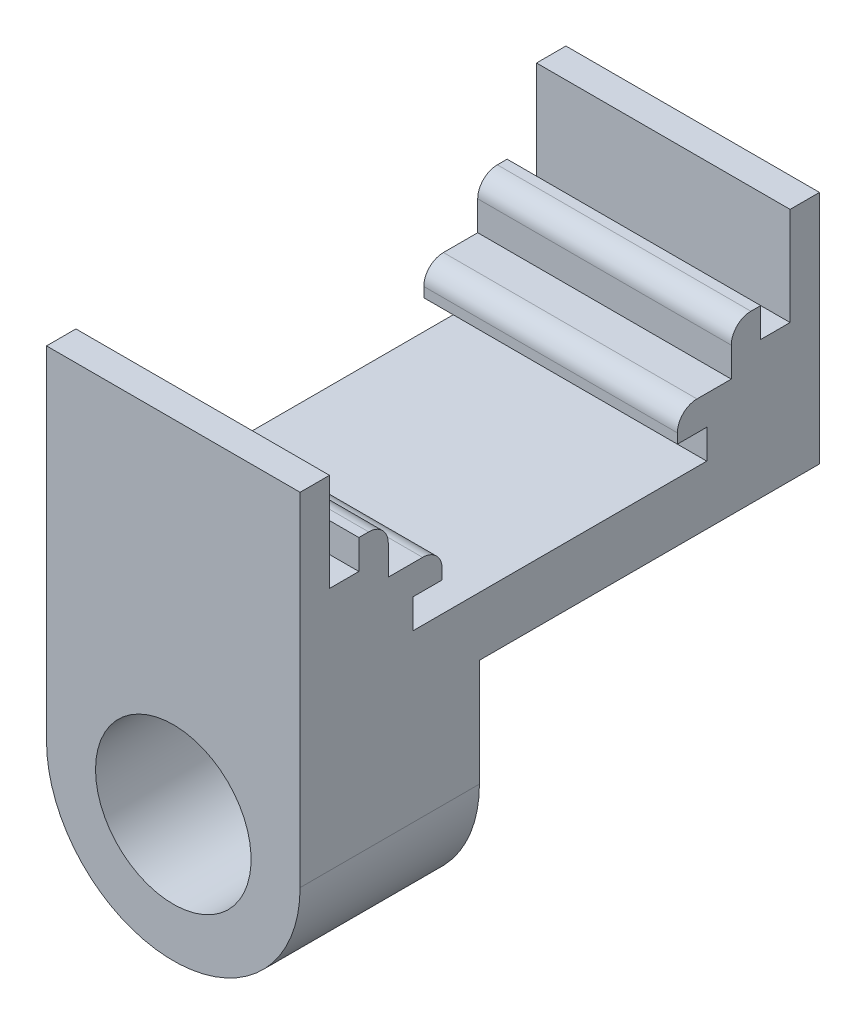
from build123d import *

# Parameters (mm, degrees)
BOSS_EXTRUDE1_DEPTH = 25.875
FILLET1_R           = 2
SKETCH2_R           = 7.9375
BOSS_EXTRUDE2_DEPTH = 18.3
SKETCH3_W           = 25.875
SKETCH3_H           = 34.7
BOSS_EXTRUDE3_DEPTH = 2


with BuildPart() as part:
    # Sketch1 → Boss-Extrude1 (new body)
    with BuildSketch(Plane(origin=(0, 0, 0), x_dir=(0, 0, -1), z_dir=(1, 0, 0))):
        Polygon((-26.5, -27.5), (-26.5, -5.5), (-23.5, -5.5), (-23.5, -15.5), (-20.5, -15.5), (-20.5, -12.5), (-17.5, -12.5), (-17.5, -17.5), (-12, -17.5), (-12, -20.5), (-15, -20.5), (-15, -23.5), (0, -23.5), (0, -27.5), align=None)
    extrude(amount=BOSS_EXTRUDE1_DEPTH)

    # Fillet1
    fillet1_edges = [part.edges().sort_by_distance(p)[0] for p in [
        (12.9375, -12.5, 17.5),
        (12.9375, -17.5, 12),
    ]]
    fillet(fillet1_edges, radius=FILLET1_R)

    # Mirror1: part across plane


with BuildPart() as part_1:
    add(part.part)
    add(part.part.mirror(Plane(origin=(25.875, -23.5, 0), x_dir=(1, 0, 0), z_dir=(0, 0, 1))))

    # Sketch2 → Boss-Extrude2 (add)
    with BuildSketch(Plane(origin=(0, 0, 26.5), x_dir=(-1, 0, 0), z_dir=(0, 0, -1))):
        with BuildLine():
            Line((-25.875, -27.5), (-25.875, -40.4375))
            ThreePointArc((-25.875, -40.4375), (-12.9375, -53.375), (0, -40.4375))
            Line((0, -40.4375), (0, -27.5))
            Line((0, -27.5), (0, -23.5))
            Line((0, -23.5), (-25.875, -23.5))
            Line((-25.875, -23.5), (-25.875, -27.5))
        make_face()
        with Locations((-12.9375, -40.4375)):
            Circle(SKETCH2_R, mode=Mode.SUBTRACT)
    extrude(amount=BOSS_EXTRUDE2_DEPTH)

    # Sketch3 → Boss-Extrude3 (add)
    with BuildSketch(Plane.XZ.offset(27.5)):
        with Locations((12.9375, -9.15)):
            Rectangle(SKETCH3_W, SKETCH3_H)
    extrude(amount=BOSS_EXTRUDE3_DEPTH)


solid = part_1.part
